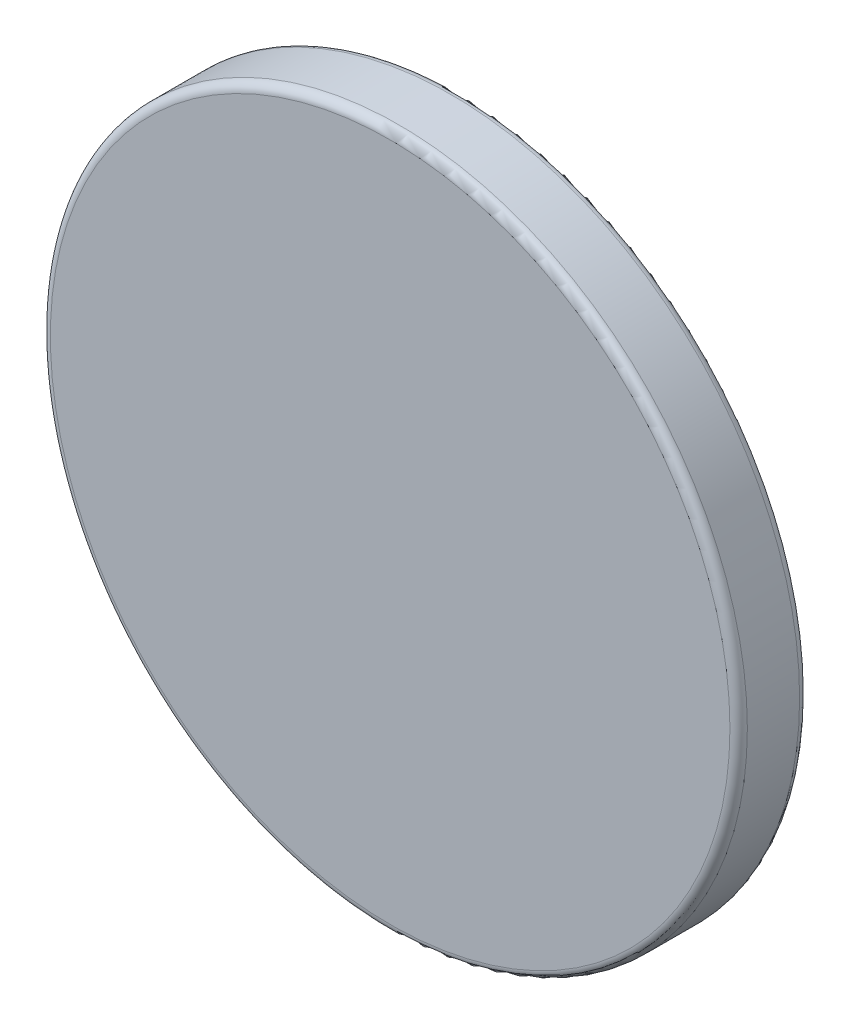
from build123d import *

# Parameters (mm, degrees)
ESQUISSE1_R        = 10
BOSS_EXTRU_1_DEPTH = 2
CONG_1_R           = 0.25


with BuildPart() as part:
    # Esquisse1 → Boss.-Extru.1 (new body)
    with BuildSketch(Plane.XY):
        Circle(ESQUISSE1_R)
    extrude(amount=BOSS_EXTRU_1_DEPTH)

    # Congé1
    cong_1_edges = [part.edges().sort_by_distance(p)[0] for p in [
        (-10, 0, 0),
        (-10, 0, 2),
    ]]
    fillet(cong_1_edges, radius=CONG_1_R)


solid = part.part
